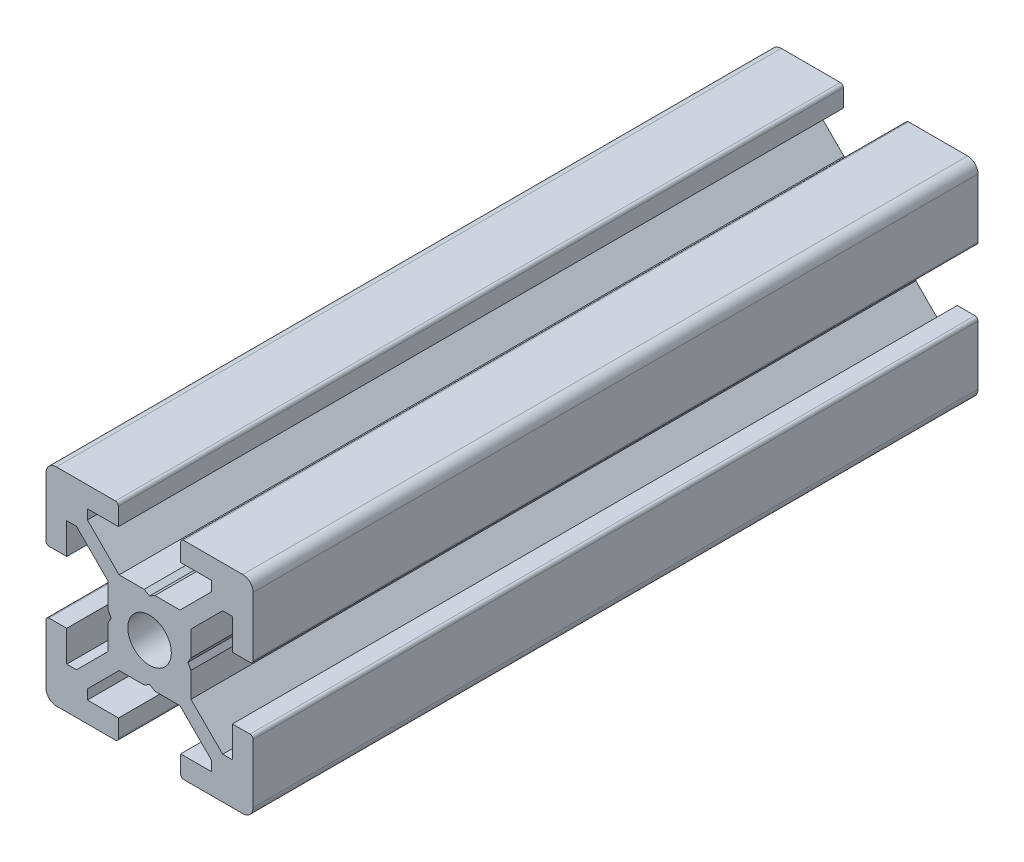
from build123d import *

# Parameters (mm, degrees)
BOSS_EXTRUDE1_DEPTH = 70
SKETCH2_W           = 400
SKETCH2_H           = 2.1


with BuildPart() as part:
    # Sketch1 → Boss-Extrude1 (new body)
    with BuildSketch(Plane.XY):
        with BuildLine():
            Line((-10, 9), (-10, 3.29999995))
            ThreePointArc((-10, 3.29999995), (-9.912132049, 3.087867916), (-9.7, 3))
            Line((-9.7, 3), (-8, 3))
            Line((-8, 3), (-8, 6))
            Line((-8, 6), (-7.060677, 6))
            Line((-7.060677, 6), (-4, 2.93932965))
            Line((-4, 2.93932965), (-4, 0.519615242))
            Line((-4, 0.519615242), (-3.699996283, -6.437e-06))
            Line((-3.699996283, -6.437e-06), (-4, -0.519628117))
            Line((-4, -0.519628117), (-4, -2.93933725))
            Line((-4, -2.93933725), (-7.0606695, -6))
            Line((-7.0606695, -6), (-8, -6))
            Line((-8, -6), (-8, -3))
            Line((-8, -3), (-9.7, -3))
            ThreePointArc((-9.7, -3), (-9.912132049, -3.087867916), (-10, -3.29999995))
            Line((-10, -3.29999995), (-10, -9))
            ThreePointArc((-10, -9), (-9.707106781, -9.707106781), (-9, -10))
            Line((-9, -10), (-3.29999995, -10))
            ThreePointArc((-3.29999995, -10), (-3.087867916, -9.912132049), (-3, -9.7))
            Line((-3, -9.7), (-3, -8))
            Line((-3, -8), (-6, -8))
            Line((-6, -8), (-6, -7.0606515))
            Line((-6, -7.0606515), (-2.9393489, -4))
            Line((-2.9393489, -4), (-0.519615242, -4))
            Line((-0.519615242, -4), (6.437e-06, -3.699996283))
            Line((6.437e-06, -3.699996283), (0.519628117, -4))
            Line((0.519628117, -4), (2.9393227, -4))
            Line((2.9393227, -4), (6, -7.060677))
            Line((6, -7.060677), (6, -8))
            Line((6, -8), (3, -8))
            Line((3, -8), (3, -9.7))
            ThreePointArc((3, -9.7), (3.087867916, -9.912132049), (3.29999995, -10))
            Line((3.29999995, -10), (9, -10))
            ThreePointArc((9, -10), (9.707106781, -9.707106781), (10, -9))
            Line((10, -9), (10, -3.29999995))
            ThreePointArc((10, -3.29999995), (9.912132049, -3.087867916), (9.7, -3))
            Line((9.7, -3), (8, -3))
            Line((8, -3), (8, -6))
            Line((8, -6), (7.0606435, -6))
            Line((7.0606435, -6), (4, -2.9393482))
            Line((4, -2.9393482), (4, -0.519615242))
            Line((4, -0.519615242), (3.699996283, 6.437e-06))
            Line((3.699996283, 6.437e-06), (4, 0.519628117))
            Line((4, 0.519628117), (4, 2.9393401))
            Line((4, 2.9393401), (7.060651, 6))
            Line((7.060651, 6), (8, 6))
            Line((8, 6), (8, 3))
            Line((8, 3), (9.7, 3))
            ThreePointArc((9.7, 3), (9.912132049, 3.087867916), (10, 3.29999995))
            Line((10, 3.29999995), (10, 9))
            ThreePointArc((10, 9), (9.707106781, 9.707106781), (9, 10))
            Line((9, 10), (3.29999995, 10))
            ThreePointArc((3.29999995, 10), (3.087867916, 9.912132049), (3, 9.7))
            Line((3, 9.7), (3, 8))
            Line((3, 8), (6, 8))
            Line((6, 8), (6, 7.060669))
            Line((6, 7.060669), (2.9393308, 4))
            Line((2.9393308, 4), (0.519615242, 4))
            Line((0.519615242, 4), (-6.437e-06, 3.699996283))
            Line((-6.437e-06, 3.699996283), (-0.519628117, 4))
            Line((-0.519628117, 4), (-2.93935655, 4))
            Line((-2.93935655, 4), (-6, 7.0606435))
            Line((-6, 7.0606435), (-6, 8))
            Line((-6, 8), (-3, 8))
            Line((-3, 8), (-3, 9.7))
            ThreePointArc((-3, 9.7), (-3.087867966, 9.912132034), (-3.3, 10))
            Line((-3.3, 10), (-9, 10))
            ThreePointArc((-9, 10), (-9.707106781, 9.707106781), (-10, 9))
        make_face()
    extrude(amount=-BOSS_EXTRUDE1_DEPTH)

    # Sketch2 → Cut-Revolve1 (revolve, cut)
    with BuildSketch(Plane(origin=(0, 0, 0), x_dir=(0, 0, -1), z_dir=(1, 0, 0)), mode=Mode.PRIVATE) as cut_revolve1_sk:
        with Locations((200, 1.05)):
            Rectangle(SKETCH2_W, SKETCH2_H)
    revolve(cut_revolve1_sk.sketch.rotate(Axis((0, 0, -400), (0, 0, 1)), 270), axis=Axis((0, 0, -400), (0, 0, 1)), mode=Mode.SUBTRACT)


solid = part.part
